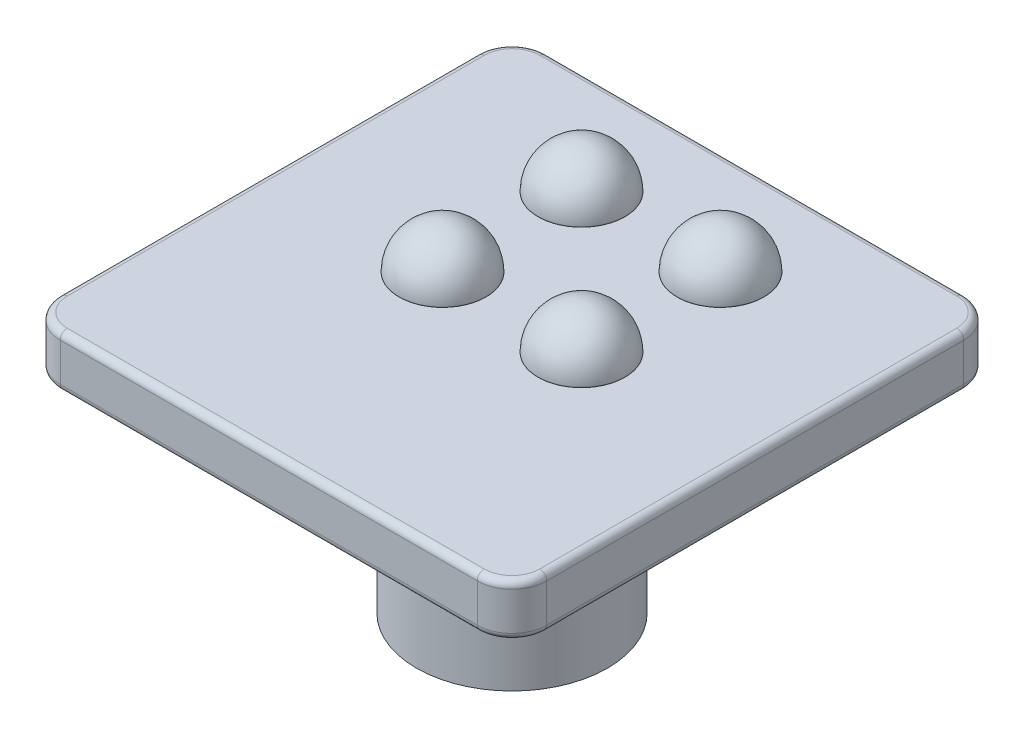
from build123d import *

# Parameters (mm, degrees)
BOSS_EXTRUDE1_DEPTH = 1.5
SKETCH2_R           = 2.75
BOSS_EXTRUDE2_DEPTH = 6
SKETCH3_W           = 1.1
SKETCH3_H           = 1.45
SKETCH3_W_2         = 1.45
SKETCH3_H_2         = 1.1
CUT_EXTRUDE1_DEPTH  = 6
CHAMFER1_SIZE       = 0.3
FILLET1_R           = 1
SKETCH4_R           = 1.25
BOSS_EXTRUDE3_DEPTH = 0.01
DOME1_FACE_RADIUS   = 1.25
DOME1_HEIGHT        = 1.25
DOME2_FACE_RADIUS   = 1.25
DOME2_HEIGHT        = 1.25
DOME3_FACE_RADIUS   = 1.25
DOME3_HEIGHT        = 1.25
DOME4_FACE_RADIUS   = 1.25
DOME4_HEIGHT        = 1.25
FILLET3_R           = 0.2


with BuildPart() as part:
    # Sketch1 → Boss-Extrude1 (new body)
    with BuildSketch(Plane(origin=(0, 0, 0), x_dir=(1, 0, 0), z_dir=(0, 1, 0))):
        with BuildLine():
            Line((-7.324675649, 4.396717546), (4.675324351, 4.396717546))
            ThreePointArc((4.675324351, 4.396717546), (5.382431132, 4.103824327), (5.675324351, 3.396717546))
            Line((5.675324351, 3.396717546), (5.675324351, -8.603282454))
            ThreePointArc((5.675324351, -8.603282454), (5.382431132, -9.310389235), (4.675324351, -9.603282454))
            Line((4.675324351, -9.603282454), (-7.324675649, -9.603282454))
            ThreePointArc((-7.324675649, -9.603282454), (-8.03178243, -9.310389235), (-8.324675649, -8.603282454))
            Line((-8.324675649, -8.603282454), (-8.324675649, 3.396717546))
            ThreePointArc((-8.324675649, 3.396717546), (-8.03178243, 4.103824327), (-7.324675649, 4.396717546))
        make_face()
    extrude(amount=BOSS_EXTRUDE1_DEPTH)

    # Sketch2 → Boss-Extrude2 (add)
    with BuildSketch(Plane.XZ):
        with Locations(Location((-1.324675649, 2.603282454, 0), (0, 0, 270))):
            Circle(SKETCH2_R)
    extrude(amount=BOSS_EXTRUDE2_DEPTH)

    # Sketch3 → Cut-Extrude1 (cut)
    with BuildSketch(Plane.XZ.offset(6)):
        with Locations((-1.324675649, 3.878282454)):
            Rectangle(SKETCH3_W, SKETCH3_H)
        with Locations((-0.049675649, 2.603282454)):
            Rectangle(SKETCH3_W_2, SKETCH3_H_2)
        with Locations((-1.324675649, 2.603282454)):
            Rectangle(SKETCH3_W, SKETCH3_H_2)
        with Locations((-2.599675649, 2.603282454)):
            Rectangle(SKETCH3_W_2, SKETCH3_H_2)
        with Locations((-1.324675649, 1.328282454)):
            Rectangle(SKETCH3_W, SKETCH3_H)
    extrude(amount=-CUT_EXTRUDE1_DEPTH, mode=Mode.SUBTRACT)

    # Chamfer1
    chamfer1_edges = [part.edges().sort_by_distance(p)[0] for p in [
        (-0.774675649, -6, 3.878282454),
        (-0.049675649, -6, 3.153282454),
        (0.675324351, -6, 2.603282454),
        (-0.774675649, -6, 1.328282454),
        (-2.599675649, -6, 3.153282454),
        (-1.324675649, -6, 4.603282454),
        (-1.874675649, -6, 3.878282454),
        (-3.324675649, -6, 2.603282454),
        (-2.599675649, -6, 2.053282454),
        (-1.874675649, -6, 1.328282454),
        (-1.324675649, -6, 0.603282454),
        (-0.049675649, -6, 2.053282454),
    ]]
    chamfer(chamfer1_edges, length=CHAMFER1_SIZE)

    # Fillet1
    fillet1_edges = [part.edges().sort_by_distance(p)[0] for p in [
        (-1.324675649, 0, 5.353282454),
    ]]
    fillet(fillet1_edges, radius=FILLET1_R)

    # Sketch4 → Boss-Extrude3 (add)
    with BuildSketch(Plane(origin=(0, 1.5, 0), x_dir=(1, 0, 0), z_dir=(0, 1, 0))):
        with Locations(Location((-3.324675649, 1.396717546, 0), (0, 0, 90))):
            Circle(SKETCH4_R)
        with Locations(Location((0.675324351, -2.603282454, 0), (0, 0, 90))):
            Circle(SKETCH4_R)
        with Locations(Location((-3.324675649, -2.603282454, 0), (0, 0, 90))):
            Circle(SKETCH4_R)
        with Locations(Location((0.675324351, 1.396717546, 0), (0, 0, 90))):
            Circle(SKETCH4_R)
    extrude(amount=BOSS_EXTRUDE3_DEPTH)

    # Dome1: a dome of height H over a round flat face of radius A is a cap of a sphere of radius (A * A + H * H) / (2 * H)
    dome1_r = (DOME1_FACE_RADIUS * DOME1_FACE_RADIUS + DOME1_HEIGHT * DOME1_HEIGHT) / (2 * DOME1_HEIGHT)
    dome1_base = Plane((-3.324675649, 1.51, -1.396717546), z_dir=(0, 1, 0))
    with Locations(dome1_base.offset(DOME1_HEIGHT - dome1_r)):
        dome1_ball = Sphere(dome1_r, mode=Mode.PRIVATE)
    add(split(dome1_ball, bisect_by=dome1_base, keep=Keep.TOP, mode=Mode.PRIVATE))

    # Dome2: a dome of height H over a round flat face of radius A is a cap of a sphere of radius (A * A + H * H) / (2 * H)
    dome2_r = (DOME2_FACE_RADIUS * DOME2_FACE_RADIUS + DOME2_HEIGHT * DOME2_HEIGHT) / (2 * DOME2_HEIGHT)
    dome2_base = Plane((0.675324351, 1.51, -1.396717546), z_dir=(0, 1, 0))
    with Locations(dome2_base.offset(DOME2_HEIGHT - dome2_r)):
        dome2_ball = Sphere(dome2_r, mode=Mode.PRIVATE)
    add(split(dome2_ball, bisect_by=dome2_base, keep=Keep.TOP, mode=Mode.PRIVATE))

    # Dome3: a dome of height H over a round flat face of radius A is a cap of a sphere of radius (A * A + H * H) / (2 * H)
    dome3_r = (DOME3_FACE_RADIUS * DOME3_FACE_RADIUS + DOME3_HEIGHT * DOME3_HEIGHT) / (2 * DOME3_HEIGHT)
    dome3_base = Plane((-3.324675649, 1.51, 2.603282454), z_dir=(0, 1, 0))
    with Locations(dome3_base.offset(DOME3_HEIGHT - dome3_r)):
        dome3_ball = Sphere(dome3_r, mode=Mode.PRIVATE)
    add(split(dome3_ball, bisect_by=dome3_base, keep=Keep.TOP, mode=Mode.PRIVATE))

    # Dome4: a dome of height H over a round flat face of radius A is a cap of a sphere of radius (A * A + H * H) / (2 * H)
    dome4_r = (DOME4_FACE_RADIUS * DOME4_FACE_RADIUS + DOME4_HEIGHT * DOME4_HEIGHT) / (2 * DOME4_HEIGHT)
    dome4_base = Plane((0.675324351, 1.51, 2.603282454), z_dir=(0, 1, 0))
    with Locations(dome4_base.offset(DOME4_HEIGHT - dome4_r)):
        dome4_ball = Sphere(dome4_r, mode=Mode.PRIVATE)
    add(split(dome4_ball, bisect_by=dome4_base, keep=Keep.TOP, mode=Mode.PRIVATE))

    # Fillet3
    fillet3_edges = [part.edges().sort_by_distance(p)[0] for p in [
        (5.382431132, 1.5, 9.310389235),
        (-1.324675649, 0, 9.603282454),
        (-8.03178243, 0, 9.310389235),
        (5.675324351, 1.5, 2.603282454),
        (5.382431132, 1.5, -4.103824327),
        (-1.324675649, 1.5, -4.396717546),
        (-8.03178243, 1.5, -4.103824327),
        (-8.324675649, 1.5, 2.603282454),
        (-8.03178243, 1.5, 9.310389235),
        (-1.324675649, 1.5, 9.603282454),
        (-8.324675649, 0, 2.603282454),
        (-8.03178243, 0, -4.103824327),
        (-1.324675649, 0, -4.396717546),
        (5.382431132, 0, -4.103824327),
        (5.675324351, 0, 2.603282454),
        (5.382431132, 0, 9.310389235),
    ]]
    fillet(fillet3_edges, radius=FILLET3_R)


solid = part.part
